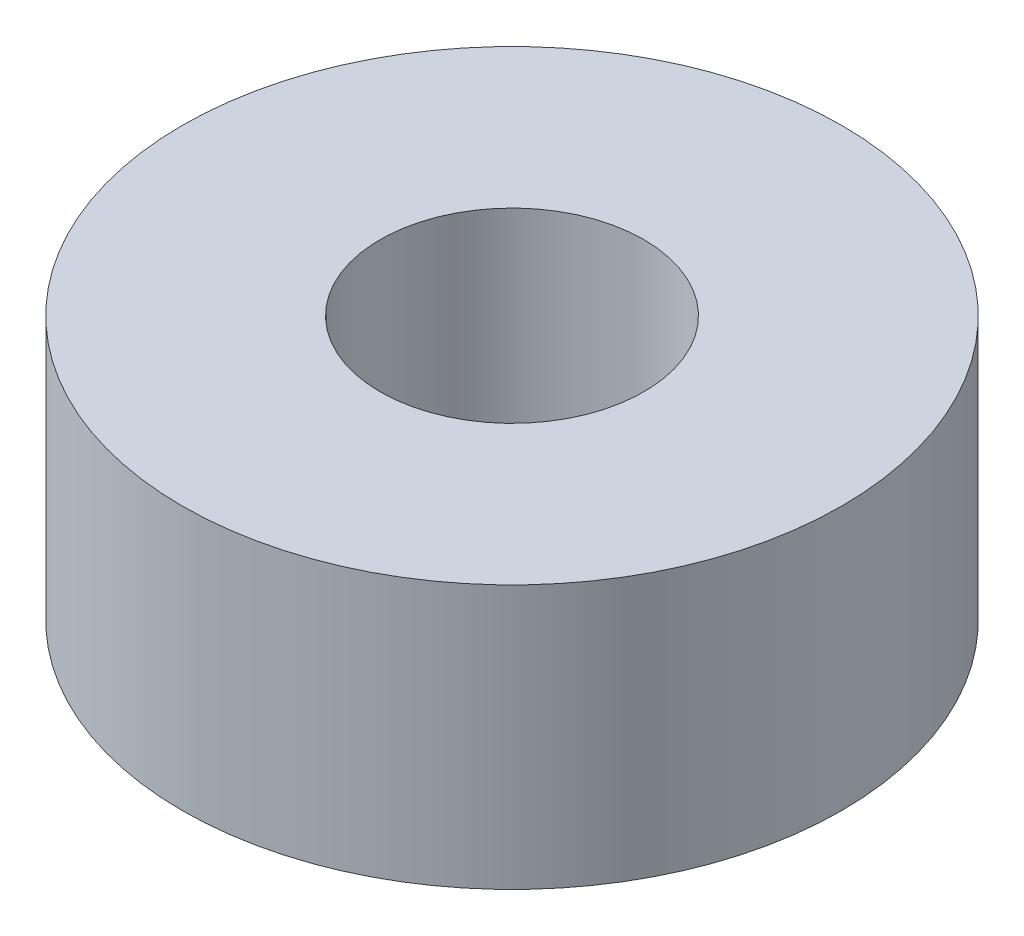
from build123d import *

# Parameters (mm, degrees)
SKETCH_1_R      = 5
SKETCH_1_R_2    = 2
EXTRUDE_1_DEPTH = 4


with BuildPart() as part:
    # 草图1 → 凸台-拉伸1 (new body)
    with BuildSketch(Plane(origin=(0, 0, 0), x_dir=(1, 0, 0), z_dir=(0, 1, 0))):
        with Locations(Location((0, 0, 0), (0, 0, 270))):
            Circle(SKETCH_1_R)
        with Locations(Location((0, 0, 0), (0, 0, 270))):
            Circle(SKETCH_1_R_2, mode=Mode.SUBTRACT)
    extrude(amount=EXTRUDE_1_DEPTH)


solid = part.part
